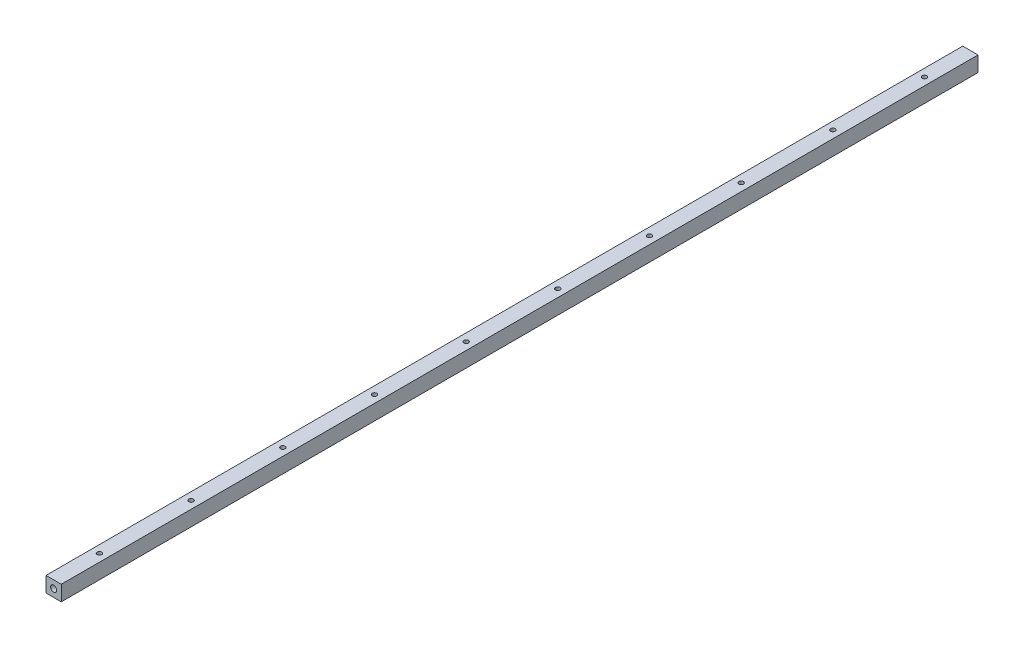
from build123d import *

# Parameters (mm, degrees)
SKETCH1_W          = 10
SKETCH1_H          = 10
EXTRUDE1_DEPTH     = 600
SKETCH2_R          = 2
CUT_EXTRUDE1_DEPTH = 20
CUT_EXTRUDE2_START = -20
SKETCH3_R          = 2
CUT_EXTRUDE2_DEPTH = 20
SKETCH4_R          = 1.5
CUT_EXTRUDE3_DEPTH = 601.166643525
LPATTERN1_COUNT    = 10
LPATTERN1_PITCH    = 60


with BuildPart() as part:
    # Sketch1 → Extrude1 (new body)
    with BuildSketch(Plane.XY):
        with Locations((5, 5)):
            Rectangle(SKETCH1_W, SKETCH1_H)
    extrude(amount=EXTRUDE1_DEPTH)

    # Sketch2 → Cut-Extrude1 (cut)
    with BuildSketch(Plane.XY.offset(600)):
        with Locations((5, 5)):
            Circle(SKETCH2_R)
    extrude(amount=-CUT_EXTRUDE1_DEPTH, mode=Mode.SUBTRACT)

    # Sketch3 → Cut-Extrude2 (cut)
    with BuildSketch(Plane(origin=(0, 0, 0), x_dir=(-1, 0, 0), z_dir=(0, 0, -1)).offset(CUT_EXTRUDE2_START)):
        with Locations(Location((-5, 5, 0), (0, 0, 180))):
            Circle(SKETCH3_R)
    extrude(amount=CUT_EXTRUDE2_DEPTH, mode=Mode.SUBTRACT)

    # Sketch4 → Cut-Extrude3 (cut, through all)
    with BuildSketch(Plane(origin=(0, 10, 0), x_dir=(-1, 0, 0), z_dir=(0, 1, 0))):
        with Locations(Location((-5, 30, 0), (0, 0, 90))):
            Circle(SKETCH4_R)
    cut_extrude3 = extrude(amount=-CUT_EXTRUDE3_DEPTH, mode=Mode.SUBTRACT)

    # LPattern1: Cut-Extrude3 ×10
    with Locations(*[(0, 0, i * LPATTERN1_PITCH) for i in range(1, LPATTERN1_COUNT)]):
        add(cut_extrude3, mode=Mode.SUBTRACT)


solid = part.part
